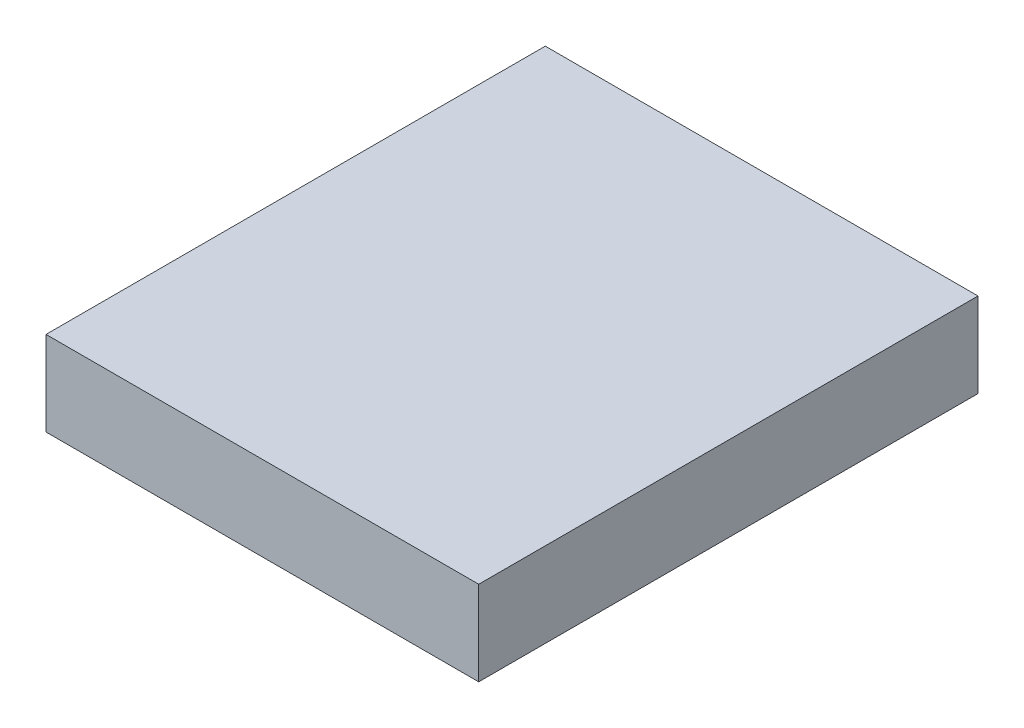
from build123d import *

# Parameters (mm, degrees)
SKETCH1_W           = 130
SKETCH1_H           = 150
BOSS_EXTRUDE1_DEPTH = 25.4


with BuildPart() as part:
    # Sketch1 → Boss-Extrude1 (new body)
    with BuildSketch(Plane(origin=(0, 0, 0), x_dir=(1, 0, 0), z_dir=(0, 1, 0))):
        with Locations((0, -75)):
            Rectangle(SKETCH1_W, SKETCH1_H)
    extrude(amount=BOSS_EXTRUDE1_DEPTH)


solid = part.part
